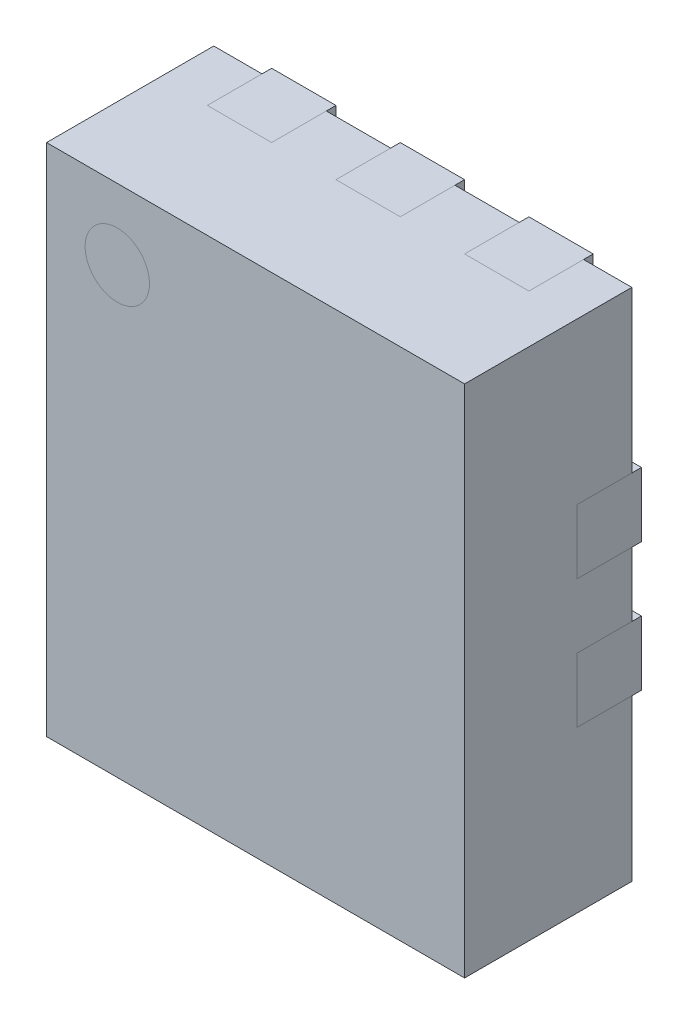
from build123d import *

# Parameters (mm, degrees)
EXTRUDE_START       = 0.03
SKETCH_1_W          = 1.3
SKETCH_1_H          = 1.6
EXTRUDE_1_DEPTH     = 0.52
SKETCH_2_R          = 0.1
CUT_EXTRUDE_1_DEPTH = 0.05
SKETCH_2_2_R        = 0.1
EXTRUDE_1_2_DEPTH   = 0.05
SKETCH_3_W          = 0.2
SKETCH_3_H          = 0.3
CUT_EXTRUDE_2_DEPTH = 0.2
EXTRUDE_2_DEPTH     = 0.2
EXTRUDE_2_2_DEPTH   = 0.2
EXTRUDE_2_3_DEPTH   = 0.2
EXTRUDE_2_4_DEPTH   = 0.2
EXTRUDE_2_5_DEPTH   = 0.2
EXTRUDE_2_6_DEPTH   = 0.2
EXTRUDE_2_7_DEPTH   = 0.2
EXTRUDE_2_8_DEPTH   = 0.2
EXTRUDE_2_9_DEPTH   = 0.2
SKETCH_3_2_W        = 0.2
SKETCH_3_2_H        = 0.3
EXTRUDE_2_10_DEPTH  = 0.2


with BuildPart() as part:
    # Эскиз1 → Extrude 1 (new body)
    with BuildSketch(Plane.XY.offset(EXTRUDE_START)):
        Rectangle(SKETCH_1_W, SKETCH_1_H)
    extrude(amount=EXTRUDE_1_DEPTH)

    # Эскиз2 → Вырез-Вытянуть1 (cut)
    with BuildSketch(Plane.XY.offset(0.55)):
        with Locations((-0.43, 0.58)):
            Circle(SKETCH_2_R)
    extrude(amount=-CUT_EXTRUDE_1_DEPTH, mode=Mode.SUBTRACT)

    # Эскиз3 → Вырез-Вытянуть2 (cut)
    with BuildSketch(Plane.XY):
        with BuildLine():
            Line((-0.01, 0.5), (0.01, 0.5))
            ThreePointArc((0.01, 0.5), (0.07363961, 0.52636039), (0.1, 0.59))
            Line((0.1, 0.59), (0.1, 0.8))
            Line((0.1, 0.8), (-0.1, 0.8))
            Line((-0.1, 0.8), (-0.1, 0.59))
            ThreePointArc((-0.1, 0.59), (-0.07363961, 0.52636039), (-0.01, 0.5))
        make_face()
        with BuildLine():
            Line((-0.01, -0.5), (0.01, -0.5))
            ThreePointArc((0.01, -0.5), (0.07363961, -0.52636039), (0.1, -0.59))
            Line((0.1, -0.59), (0.1, -0.8))
            Line((0.1, -0.8), (-0.1, -0.8))
            Line((-0.1, -0.8), (-0.1, -0.59))
            ThreePointArc((-0.1, -0.59), (-0.07363961, -0.52636039), (-0.01, -0.5))
        make_face()
        with BuildLine():
            Line((-0.41, -0.5), (-0.39, -0.5))
            ThreePointArc((-0.39, -0.5), (-0.32636039, -0.52636039), (-0.3, -0.59))
            Line((-0.3, -0.59), (-0.3, -0.8))
            Line((-0.3, -0.8), (-0.5, -0.8))
            Line((-0.5, -0.8), (-0.5, -0.59))
            ThreePointArc((-0.5, -0.59), (-0.47363961, -0.52636039), (-0.41, -0.5))
        make_face()
        with BuildLine():
            Line((0.3, -0.8), (0.5, -0.8))
            Line((0.5, -0.8), (0.5, -0.59))
            ThreePointArc((0.5, -0.59), (0.47363961, -0.52636039), (0.41, -0.5))
            Line((0.41, -0.5), (0.39, -0.5))
            ThreePointArc((0.39, -0.5), (0.32636039, -0.52636039), (0.3, -0.59))
            Line((0.3, -0.59), (0.3, -0.8))
        make_face()
        with BuildLine():
            Line((0.65, -0.1), (0.65, -0.3))
            Line((0.65, -0.3), (0.34, -0.3))
            ThreePointArc((0.34, -0.3), (0.27636039, -0.27363961), (0.25, -0.21))
            Line((0.25, -0.21), (0.25, -0.19))
            ThreePointArc((0.25, -0.19), (0.27636039, -0.12636039), (0.34, -0.1))
            Line((0.34, -0.1), (0.65, -0.1))
        make_face()
        with BuildLine():
            Line((0.34, 0.1), (0.65, 0.1))
            Line((0.65, 0.1), (0.65, 0.3))
            Line((0.65, 0.3), (0.34, 0.3))
            ThreePointArc((0.34, 0.3), (0.27636039, 0.27363961), (0.25, 0.21))
            Line((0.25, 0.21), (0.25, 0.19))
            ThreePointArc((0.25, 0.19), (0.27636039, 0.12636039), (0.34, 0.1))
        make_face()
        with BuildLine():
            Line((-0.65, -0.1), (-0.65, -0.3))
            Line((-0.65, -0.3), (-0.34, -0.3))
            ThreePointArc((-0.34, -0.3), (-0.27636039, -0.27363961), (-0.25, -0.21))
            Line((-0.25, -0.21), (-0.25, -0.19))
            ThreePointArc((-0.25, -0.19), (-0.27636039, -0.12636039), (-0.34, -0.1))
            Line((-0.34, -0.1), (-0.65, -0.1))
        make_face()
        with BuildLine():
            Line((-0.25, 0.19), (-0.25, 0.21))
            ThreePointArc((-0.25, 0.21), (-0.27636039, 0.27363961), (-0.34, 0.3))
            Line((-0.34, 0.3), (-0.65, 0.3))
            Line((-0.65, 0.3), (-0.65, 0.1))
            Line((-0.65, 0.1), (-0.34, 0.1))
            ThreePointArc((-0.34, 0.1), (-0.27636039, 0.12636039), (-0.25, 0.19))
        make_face()
        with BuildLine():
            Line((0.3, 0.59), (0.3, 0.8))
            Line((0.3, 0.8), (0.5, 0.8))
            Line((0.5, 0.8), (0.5, 0.59))
            ThreePointArc((0.5, 0.59), (0.47363961, 0.52636039), (0.41, 0.5))
            Line((0.41, 0.5), (0.39, 0.5))
            ThreePointArc((0.39, 0.5), (0.32636039, 0.52636039), (0.3, 0.59))
        make_face()
        with Locations((-0.4, 0.65)):
            Rectangle(SKETCH_3_W, SKETCH_3_H)
    extrude(amount=CUT_EXTRUDE_2_DEPTH, mode=Mode.SUBTRACT)


with BuildPart() as body_2:
    # Эскиз2<2> → Extrude 1 2 (new body)
    with BuildSketch(Plane.XY.offset(0.55)):
        with Locations((-0.43, 0.58)):
            Circle(SKETCH_2_2_R)
    extrude(amount=-EXTRUDE_1_2_DEPTH)


with BuildPart() as body_3:
    # Эскиз3<2> → Бобышка-Вытянуть2 (new body)
    with BuildSketch(Plane.XY):
        with BuildLine():
            Line((-0.01, 0.5), (0.01, 0.5))
            ThreePointArc((0.01, 0.5), (0.07363961, 0.52636039), (0.1, 0.59))
            Line((0.1, 0.59), (0.1, 0.8))
            Line((0.1, 0.8), (-0.1, 0.8))
            Line((-0.1, 0.8), (-0.1, 0.59))
            ThreePointArc((-0.1, 0.59), (-0.07363961, 0.52636039), (-0.01, 0.5))
        make_face()
    extrude(amount=EXTRUDE_2_DEPTH)


with BuildPart() as body_4:
    # Эскиз3<2> → Extrude 2 2 (new body)
    with BuildSketch(Plane.XY):
        with BuildLine():
            Line((-0.01, -0.5), (0.01, -0.5))
            ThreePointArc((0.01, -0.5), (0.07363961, -0.52636039), (0.1, -0.59))
            Line((0.1, -0.59), (0.1, -0.8))
            Line((0.1, -0.8), (-0.1, -0.8))
            Line((-0.1, -0.8), (-0.1, -0.59))
            ThreePointArc((-0.1, -0.59), (-0.07363961, -0.52636039), (-0.01, -0.5))
        make_face()
    extrude(amount=EXTRUDE_2_2_DEPTH)


with BuildPart() as body_5:
    # Эскиз3<2> → Extrude 2 3 (new body)
    with BuildSketch(Plane.XY):
        with BuildLine():
            Line((-0.41, -0.5), (-0.39, -0.5))
            ThreePointArc((-0.39, -0.5), (-0.32636039, -0.52636039), (-0.3, -0.59))
            Line((-0.3, -0.59), (-0.3, -0.8))
            Line((-0.3, -0.8), (-0.5, -0.8))
            Line((-0.5, -0.8), (-0.5, -0.59))
            ThreePointArc((-0.5, -0.59), (-0.47363961, -0.52636039), (-0.41, -0.5))
        make_face()
    extrude(amount=EXTRUDE_2_3_DEPTH)


with BuildPart() as body_6:
    # Эскиз3<2> → Extrude 2 4 (new body)
    with BuildSketch(Plane.XY):
        with BuildLine():
            Line((0.3, -0.8), (0.5, -0.8))
            Line((0.5, -0.8), (0.5, -0.59))
            ThreePointArc((0.5, -0.59), (0.47363961, -0.52636039), (0.41, -0.5))
            Line((0.41, -0.5), (0.39, -0.5))
            ThreePointArc((0.39, -0.5), (0.32636039, -0.52636039), (0.3, -0.59))
            Line((0.3, -0.59), (0.3, -0.8))
        make_face()
    extrude(amount=EXTRUDE_2_4_DEPTH)


with BuildPart() as body_7:
    # Эскиз3<2> → Extrude 2 5 (new body)
    with BuildSketch(Plane.XY):
        with BuildLine():
            Line((0.65, -0.1), (0.65, -0.3))
            Line((0.65, -0.3), (0.34, -0.3))
            ThreePointArc((0.34, -0.3), (0.27636039, -0.27363961), (0.25, -0.21))
            Line((0.25, -0.21), (0.25, -0.19))
            ThreePointArc((0.25, -0.19), (0.27636039, -0.12636039), (0.34, -0.1))
            Line((0.34, -0.1), (0.65, -0.1))
        make_face()
    extrude(amount=EXTRUDE_2_5_DEPTH)


with BuildPart() as body_8:
    # Эскиз3<2> → Extrude 2 6 (new body)
    with BuildSketch(Plane.XY):
        with BuildLine():
            Line((0.34, 0.1), (0.65, 0.1))
            Line((0.65, 0.1), (0.65, 0.3))
            Line((0.65, 0.3), (0.34, 0.3))
            ThreePointArc((0.34, 0.3), (0.27636039, 0.27363961), (0.25, 0.21))
            Line((0.25, 0.21), (0.25, 0.19))
            ThreePointArc((0.25, 0.19), (0.27636039, 0.12636039), (0.34, 0.1))
        make_face()
    extrude(amount=EXTRUDE_2_6_DEPTH)


with BuildPart() as body_9:
    # Эскиз3<2> → Extrude 2 7 (new body)
    with BuildSketch(Plane.XY):
        with BuildLine():
            Line((-0.65, -0.1), (-0.65, -0.3))
            Line((-0.65, -0.3), (-0.34, -0.3))
            ThreePointArc((-0.34, -0.3), (-0.27636039, -0.27363961), (-0.25, -0.21))
            Line((-0.25, -0.21), (-0.25, -0.19))
            ThreePointArc((-0.25, -0.19), (-0.27636039, -0.12636039), (-0.34, -0.1))
            Line((-0.34, -0.1), (-0.65, -0.1))
        make_face()
    extrude(amount=EXTRUDE_2_7_DEPTH)


with BuildPart() as body_10:
    # Эскиз3<2> → Extrude 2 8 (new body)
    with BuildSketch(Plane.XY):
        with BuildLine():
            Line((-0.25, 0.19), (-0.25, 0.21))
            ThreePointArc((-0.25, 0.21), (-0.27636039, 0.27363961), (-0.34, 0.3))
            Line((-0.34, 0.3), (-0.65, 0.3))
            Line((-0.65, 0.3), (-0.65, 0.1))
            Line((-0.65, 0.1), (-0.34, 0.1))
            ThreePointArc((-0.34, 0.1), (-0.27636039, 0.12636039), (-0.25, 0.19))
        make_face()
    extrude(amount=EXTRUDE_2_8_DEPTH)


with BuildPart() as body_11:
    # Эскиз3<2> → Extrude 2 9 (new body)
    with BuildSketch(Plane.XY):
        with BuildLine():
            Line((0.3, 0.59), (0.3, 0.8))
            Line((0.3, 0.8), (0.5, 0.8))
            Line((0.5, 0.8), (0.5, 0.59))
            ThreePointArc((0.5, 0.59), (0.47363961, 0.52636039), (0.41, 0.5))
            Line((0.41, 0.5), (0.39, 0.5))
            ThreePointArc((0.39, 0.5), (0.32636039, 0.52636039), (0.3, 0.59))
        make_face()
    extrude(amount=EXTRUDE_2_9_DEPTH)


with BuildPart() as body_12:
    # Эскиз3<2> → Extrude 2 10 (new body)
    with BuildSketch(Plane.XY):
        with Locations((-0.4, 0.65)):
            Rectangle(SKETCH_3_2_W, SKETCH_3_2_H)
    extrude(amount=EXTRUDE_2_10_DEPTH)


solid = Compound([part.part, body_2.part, body_3.part, body_4.part, body_5.part, body_6.part, body_7.part, body_8.part, body_9.part, body_10.part, body_11.part, body_12.part])
